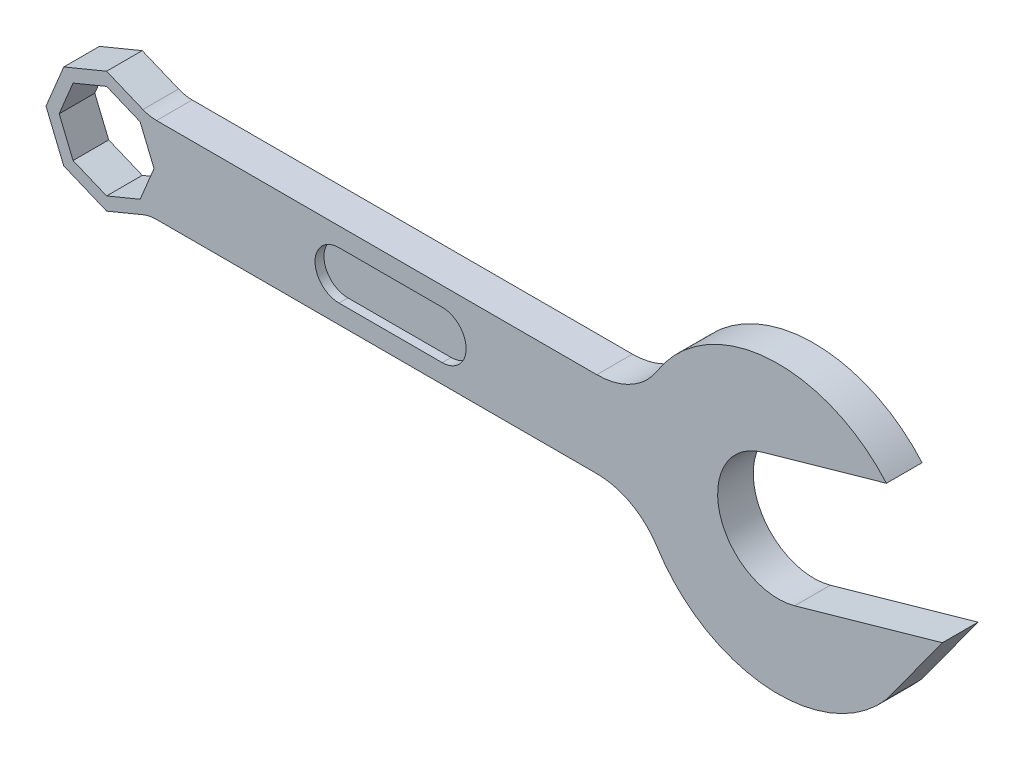
from build123d import *

# Parameters (mm, degrees)
BOSS_EXTRUDE1_DEPTH     = 5
BOSS_EXTRUDE2_DEPTH     = 2.5
CUT_EXTRUDE1_DEPTH      = 150.653904127
CUT_EXTRUDE1_DEPTH_BACK = 150.653904127


with BuildPart() as part:
    # Sketch1 → Boss-Extrude1 (new, symmetric)
    with BuildSketch(Plane.XY):
        with BuildLine():
            Line((56.958357345, 16.35690948), (91.94062397, 26.262392372))
            ThreePointArc((91.94062397, 26.262392372), (58.546836742, 40.020208922), (27.617225647, 21.371302811))
            ThreePointArc((27.617225647, 21.371302811), (20.358110781, 14.513813118), (10.688318885, 12.02081528))
            Line((10.688318885, 12.02081528), (-112.81430605, 12.02081528))
            ThreePointArc((-112.81430605, 12.02081528), (-114.76520927, 12.212962476), (-116.641140374, 12.782019955))
            Line((-116.641140374, 12.782019955), (-126.824245004, 17))
            Line((-126.824245004, 17), (-138.845060284, 12.02081528))
            Line((-138.845060284, 12.02081528), (-143.824245004, 0))
            Line((-143.824245004, 0), (-138.845060284, -12.02081528))
            Line((-138.845060284, -12.02081528), (-126.824245004, -17))
            Line((-126.824245004, -17), (-116.641140374, -12.782019955))
            ThreePointArc((-116.641140374, -12.782019955), (-114.76520927, -12.212962476), (-112.81430605, -12.02081528))
            Line((-112.81430605, -12.02081528), (10.688318885, -12.02081528))
            ThreePointArc((10.688318885, -12.02081528), (20.358110781, -14.513813118), (27.617225647, -21.371302811))
            ThreePointArc((27.617225647, -21.371302811), (58.546836742, -40.020208922), (91.94062397, -26.262392372))
            Line((91.94062397, -26.262392372), (107.630769277, -4.631577729))
            Line((107.630769277, -4.631577729), (66.221512803, -16.35690948))
            ThreePointArc((66.221512803, -16.35690948), (45.233025594, -4.631577729), (56.958357345, 16.35690948))
        make_face()
        with BuildLine():
            ThreePointArc((-61.622122108, -6.728166576), (-68.350288684, 0), (-61.622122108, 6.728166576))
            Line((-61.622122108, 6.728166576), (-32.694798011, 6.728166576))
            ThreePointArc((-32.694798011, 6.728166576), (-25.966631435, 0), (-32.694798011, -6.728166576))
            Line((-32.694798011, -6.728166576), (-61.622122108, -6.728166576))
        make_face(mode=Mode.SUBTRACT)
    extrude(amount=BOSS_EXTRUDE1_DEPTH, both=True)

    # Sketch1<3> → Boss-Extrude2 (add, symmetric)
    with BuildSketch(Plane.XY):
        with BuildLine():
            Line((-32.694798011, 6.728166576), (-61.622122108, 6.728166576))
            ThreePointArc((-61.622122108, 6.728166576), (-68.350288684, 0), (-61.622122108, -6.728166576))
            Line((-61.622122108, -6.728166576), (-32.694798011, -6.728166576))
            ThreePointArc((-32.694798011, -6.728166576), (-25.966631435, 0), (-32.694798011, 6.728166576))
        make_face()
    extrude(amount=BOSS_EXTRUDE2_DEPTH, both=True)

    # Sketch2 → Cut-Extrude1 (cut, two sides: drawn at the far end of the back side and taken through both)
    with BuildSketch(Plane.XY.offset(5).offset(-CUT_EXTRUDE1_DEPTH_BACK)):
        Polygon((-126.824245004, 13.306981608), (-136.233701936, 9.409456932), (-140.131226612, 0), (-136.233701936, -9.409456932), (-126.824245004, -13.306981608), (-117.414788072, -9.409456932), (-113.517263396, 0), (-117.414788072, 9.409456932), align=None)
    extrude(amount=CUT_EXTRUDE1_DEPTH + CUT_EXTRUDE1_DEPTH_BACK, mode=Mode.SUBTRACT)


solid = part.part
